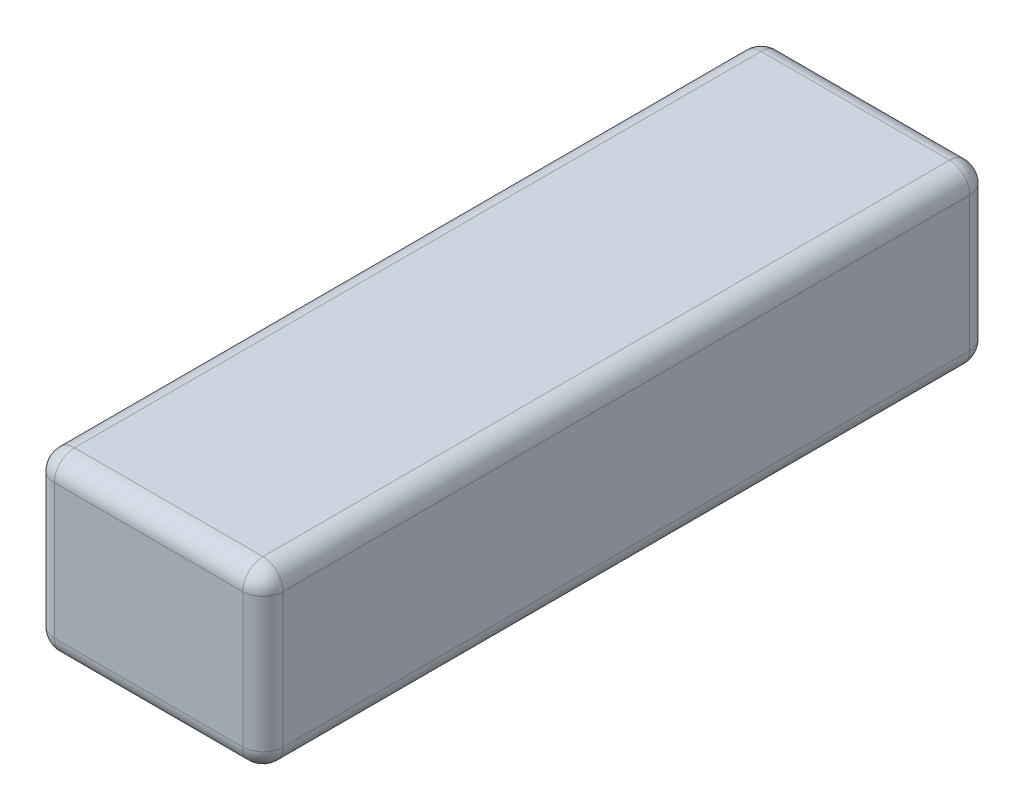
from build123d import *

# Parameters (mm, degrees)
BOSS_EXTRUDE1_DEPTH = 17
FILLET1_R           = 3


with BuildPart() as part:
    # Sketch1 → Boss-Extrude1 (new, symmetric)
    with BuildSketch(Plane(origin=(0, 0, 0), x_dir=(0, 0, -1), z_dir=(1, 0, 0))):
        with BuildLine():
            Line((-51, 13), (51, 13))
            ThreePointArc((51, 13), (53.121320344, 12.121320344), (54, 10))
            Line((54, 10), (54, -10))
            ThreePointArc((54, -10), (53.121320344, -12.121320344), (51, -13))
            Line((51, -13), (-51, -13))
            ThreePointArc((-51, -13), (-53.121320344, -12.121320344), (-54, -10))
            Line((-54, -10), (-54, 10))
            ThreePointArc((-54, 10), (-53.121320344, 12.121320344), (-51, 13))
        make_face()
    extrude(amount=BOSS_EXTRUDE1_DEPTH, both=True)

    # Fillet1
    fillet1_edges = [part.edges().sort_by_distance(p)[0] for p in [
        (17, 12.121320344, 53.121320344),
        (-17, 13, 0),
        (-17, 12.121320344, -53.121320344),
        (17, 0, 54),
        (17, -12.121320344, 53.121320344),
        (17, -13, 0),
        (17, -12.121320344, -53.121320344),
        (17, 0, -54),
        (17, 12.121320344, -53.121320344),
        (17, 13, 0),
        (-17, 0, -54),
        (-17, -12.121320344, -53.121320344),
        (-17, -13, 0),
        (-17, -12.121320344, 53.121320344),
        (-17, 0, 54),
        (-17, 12.121320344, 53.121320344),
    ]]
    fillet(fillet1_edges, radius=FILLET1_R)


solid = part.part
